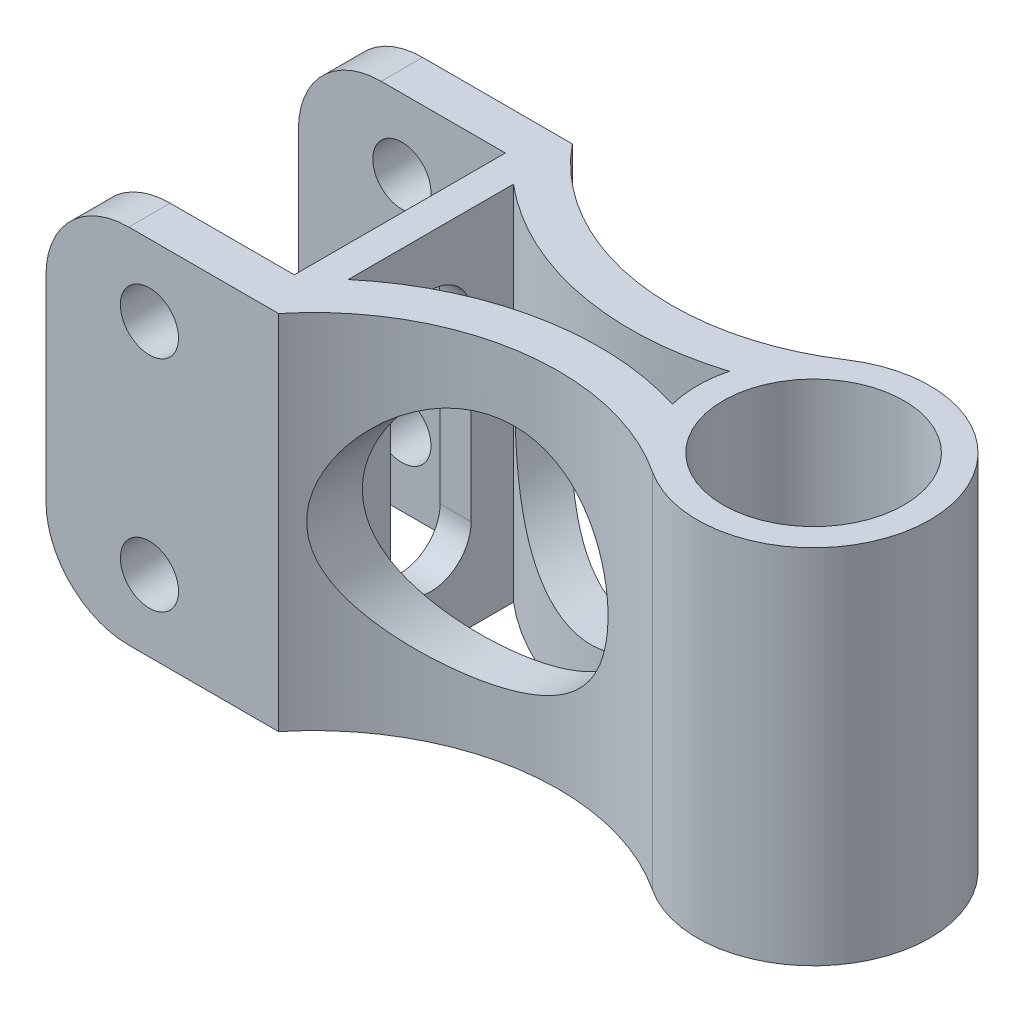
from build123d import *

# Parameters (mm, degrees)
SKETCH1_R               = 11.1
BOSS_EXTRUDE1_DEPTH     = 44.45
CUT_EXTRUDE1_REACH      = 82.845
SKETCH3_R               = 14.2875
CUT_EXTRUDE2_DEPTH      = 50.8
F_1_4_CLEARANCE_HOLE1_D = 7.14248
FILLET5_R               = 10.16


with BuildPart() as part:
    # Sketch1 → Boss-Extrude1 (new body)
    with BuildSketch(Plane(origin=(0, 0, 0), x_dir=(1, 0, 0), z_dir=(0, 1, 0))):
        with BuildLine():
            Line((-76.2, 12.954), (-50.8, 12.954))
            Line((-50.8, 12.954), (-50.8, -12.954))
            Line((-50.8, -12.954), (-76.2, -12.954))
            Line((-76.2, -12.954), (-76.2, -18.034))
            Line((-76.2, -18.034), (-50.8, -18.034))
            Line((-50.8, -18.034), (-47.655215915, -18.034))
            ThreePointArc((-47.655215915, -18.034), (-28.934565222, -7.31168908), (-7.858432995, -11.919005456))
            ThreePointArc((-7.858432995, -11.919005456), (14.27647226, 0), (-7.858432995, 11.919005456))
            ThreePointArc((-7.858432995, 11.919005456), (-28.934565222, 7.31168908), (-47.655215915, 18.034))
            Line((-47.655215915, 18.034), (-50.8, 18.034))
            Line((-50.8, 18.034), (-50.907646935, 18.034))
            Line((-50.907646935, 18.034), (-76.2, 18.034))
            Line((-76.2, 18.034), (-76.2, 12.954))
        make_face()
        with BuildLine():
            Line((-46.99, -10.141749752), (-46.99, 10.141749752))
            ThreePointArc((-46.99, 10.141749752), (-31.26726895, 2.566739092), (-13.840035745, 3.503008817))
            ThreePointArc((-13.840035745, 3.503008817), (-14.27647226, 0), (-13.840035745, -3.503008817))
            ThreePointArc((-13.840035745, -3.503008817), (-31.26726895, -2.566739092), (-46.99, -10.141749752))
        make_face(mode=Mode.SUBTRACT)
        Circle(SKETCH1_R, mode=Mode.SUBTRACT)
    extrude(amount=BOSS_EXTRUDE1_DEPTH)

    # Sketch2 → Cut-Extrude1 (cut, up to next)
    with BuildSketch(Plane.ZY.offset(50.8), mode=Mode.PRIVATE) as cut_extrude1_sk1:
        with BuildLine():
            Line((4.944497397, 33.298849711), (4.944497397, 11.151150289))
            ThreePointArc((4.944497397, 11.151150289), (0, 6.206652892), (-4.944497397, 11.151150289))
            Line((-4.944497397, 11.151150289), (-4.944497397, 33.298849711))
            ThreePointArc((-4.944497397, 33.298849711), (0, 38.243347108), (4.944497397, 33.298849711))
        make_face()
    cut_extrude1_tool1 = extrude(cut_extrude1_sk1.sketch, amount=-CUT_EXTRUDE1_REACH, mode=Mode.PRIVATE) & part.part
    add(cut_extrude1_tool1.solids().sort_by_distance((-50.8, 22.225, 0))[0], mode=Mode.SUBTRACT)

    # Sketch3 → Cut-Extrude2 (cut)
    with BuildSketch(Plane.XY.offset(18.034)):
        with Locations((-31.75, 22.225)):
            Circle(SKETCH3_R)
    extrude(amount=-CUT_EXTRUDE2_DEPTH, mode=Mode.SUBTRACT)

    # 1/4 Clearance Hole1 (through all)
    with Locations(Plane.XY.offset(18.034)):
        with Locations((-63.5, 35.687), (-63.5, 8.763)):
            Hole(F_1_4_CLEARANCE_HOLE1_D / 2)

    # Fillet5
    fillet5_edges = [part.edges().sort_by_distance(p)[0] for p in [
        (-76.2, 0, -15.494),
        (-76.2, 0, 15.494),
        (-76.2, 44.45, -15.494),
        (-76.2, 44.45, 15.494),
    ]]
    fillet(fillet5_edges, radius=FILLET5_R)


solid = part.part
